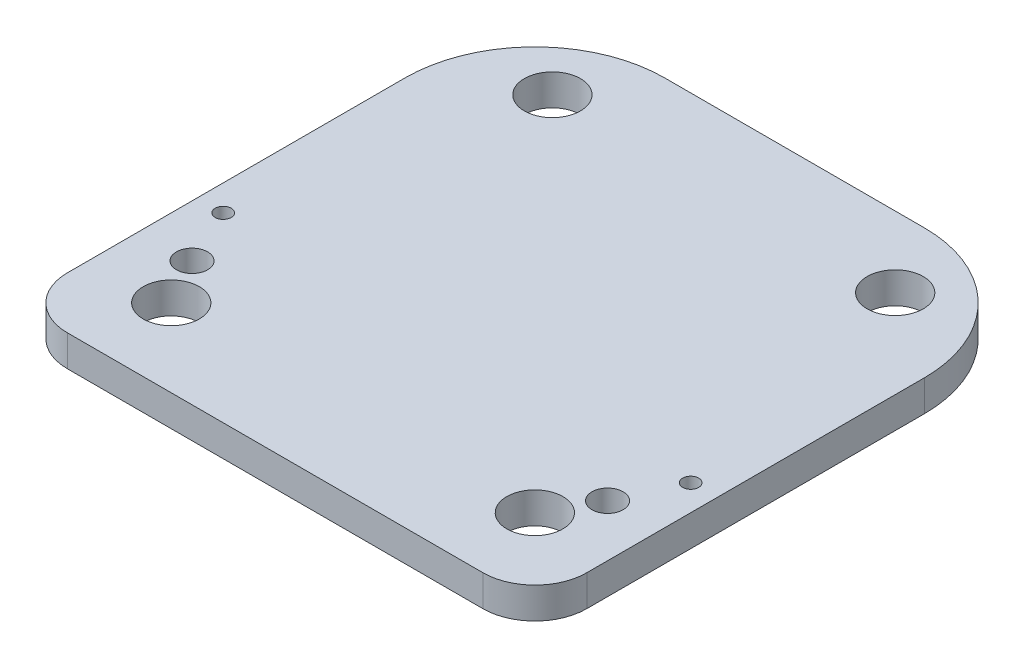
from build123d import *

# Parameters (mm, degrees)
DODANIE_WYCI_GNI_CIE1_DEPTH = 6
SZKIC2_R                    = 5.4
WYTNIJ_WYCI_GNI_CIE1_DEPTH  = 142.548578234
SZKIC3_R                    = 1.55
WYTNIJ_WYCI_GNI_CIE2_DEPTH  = 142.548578234
SZKIC4_R                    = 3
WYTNIJ_WYCI_GNI_CIE3_DEPTH  = 142.548578234


with BuildPart() as part:
    # Szkic1 → Dodanie-wyciągnięcie1 (new body)
    with BuildSketch(Plane(origin=(0, 0, 0), x_dir=(1, 0, 0), z_dir=(0, 1, 0))):
        with BuildLine():
            Line((10, 0), (90, 0))
            ThreePointArc((90, 0), (97.071067812, 2.928932188), (100, 10))
            Line((100, 10), (100, 75))
            ThreePointArc((100, 75), (92.67766953, 92.67766953), (75, 100))
            Line((75, 100), (25, 100))
            ThreePointArc((25, 100), (7.32233047, 92.67766953), (0, 75))
            Line((0, 75), (0, 10))
            ThreePointArc((0, 10), (2.928932188, 2.928932188), (10, 0))
        make_face()
    extrude(amount=-DODANIE_WYCI_GNI_CIE1_DEPTH)

    # Szkic2 → Wytnij-wyciągnięcie1 (cut, through all)
    with BuildSketch(Plane(origin=(0, 0, 0), x_dir=(1, 0, 0), z_dir=(0, 1, 0))):
        with Locations(Location((17, 86.378345537, 0), (0, 0, 270))):
            Circle(SZKIC2_R)
        with Locations(Location((83, 86.378345537, 0), (0, 0, 270))):
            Circle(SZKIC2_R)
        with Locations(Location((15, 15, 0), (0, 0, 270))):
            Circle(SZKIC2_R)
        with Locations(Location((85, 15, 0), (0, 0, 270))):
            Circle(SZKIC2_R)
    extrude(amount=-WYTNIJ_WYCI_GNI_CIE1_DEPTH, mode=Mode.SUBTRACT)

    # Szkic3 → Wytnij-wyciągnięcie2 (cut, through all)
    with BuildSketch(Plane.XZ.offset(6)):
        with Locations(Location((5, -35, 0), (0, 0, 270))):
            Circle(SZKIC3_R)
        with Locations(Location((95, -35, 0), (0, 0, 270))):
            Circle(SZKIC3_R)
    extrude(amount=-WYTNIJ_WYCI_GNI_CIE2_DEPTH, mode=Mode.SUBTRACT)

    # Szkic4 → Wytnij-wyciągnięcie3 (cut, through all)
    with BuildSketch(Plane(origin=(0, 0, 0), x_dir=(1, 0, 0), z_dir=(0, 1, 0))):
        with Locations(Location((90, 24, 0), (0, 0, 270))):
            Circle(SZKIC4_R)
        with Locations(Location((10, 24, 0), (0, 0, 270))):
            Circle(SZKIC4_R)
    extrude(amount=-WYTNIJ_WYCI_GNI_CIE3_DEPTH, mode=Mode.SUBTRACT)


solid = part.part
